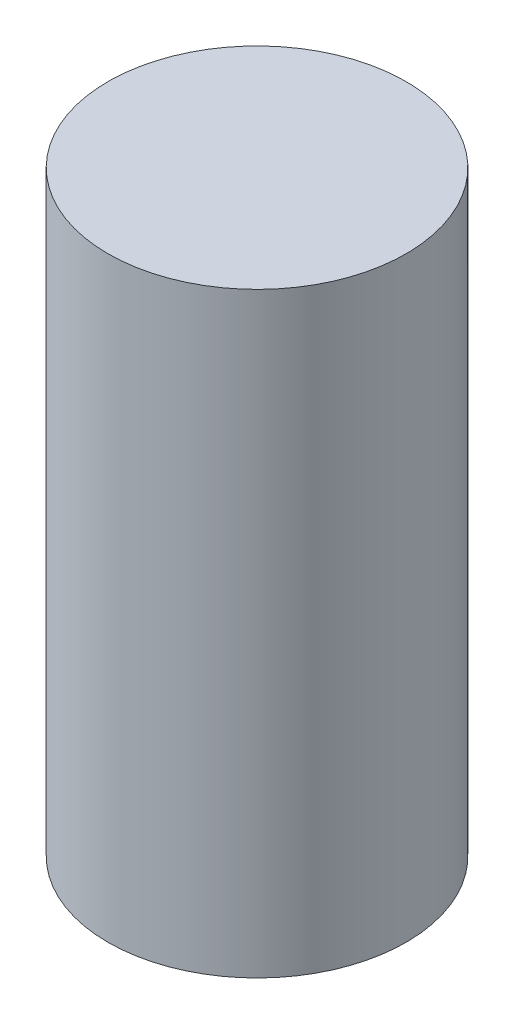
from build123d import *

# Parameters (mm, degrees)
SKETCH_1_R      = 10
EXTRUDE_1_DEPTH = 40


with BuildPart() as part:
    # 草图1 → 凸台-拉伸1 (new body)
    with BuildSketch(Plane(origin=(0, 0, 0), x_dir=(1, 0, 0), z_dir=(0, 1, 0))):
        with Locations(Location((0, 0, 0), (0, 0, 270))):
            Circle(SKETCH_1_R)
    extrude(amount=EXTRUDE_1_DEPTH)


solid = part.part
